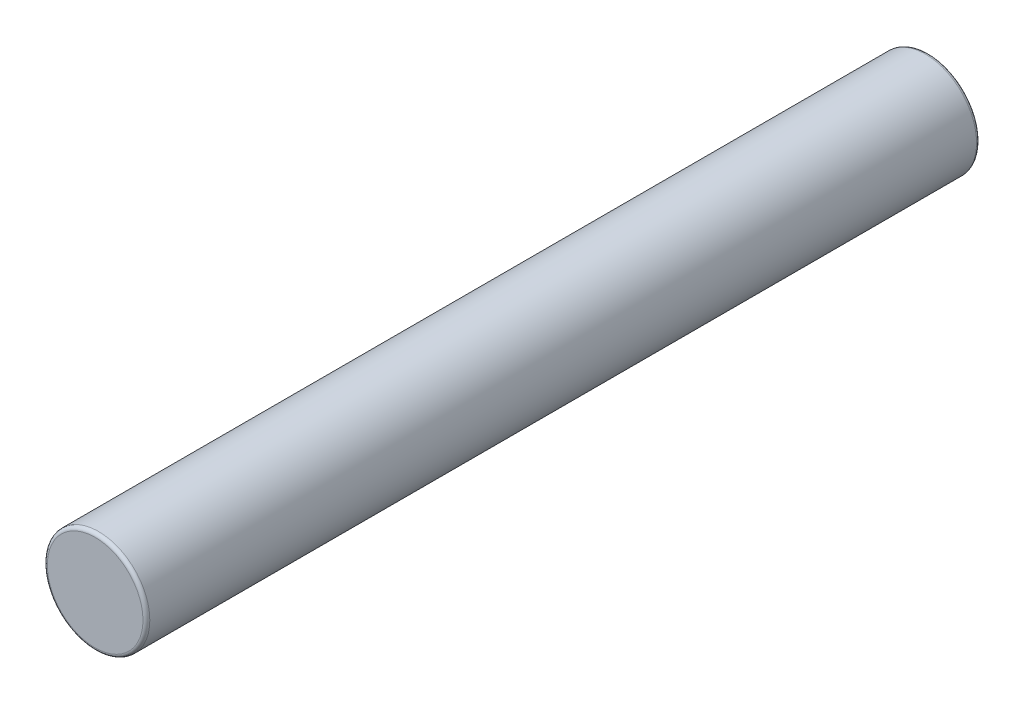
from build123d import *

# Parameters (mm, degrees)
SKETCH_1_R      = 0.75
EXTRUDE_1_DEPTH = 12.2
FILLET_1_R      = 0.05


with BuildPart() as part:
    # 草圖1 → 伸長1 (new body)
    with BuildSketch(Plane.XY):
        Circle(SKETCH_1_R)
    extrude(amount=EXTRUDE_1_DEPTH)

    # 圓角1
    fillet_1_edges = [part.edges().sort_by_distance(p)[0] for p in [
        (-0.75, 0, 0),
        (-0.75, 0, 12.2),
    ]]
    fillet(fillet_1_edges, radius=FILLET_1_R)


solid = part.part
